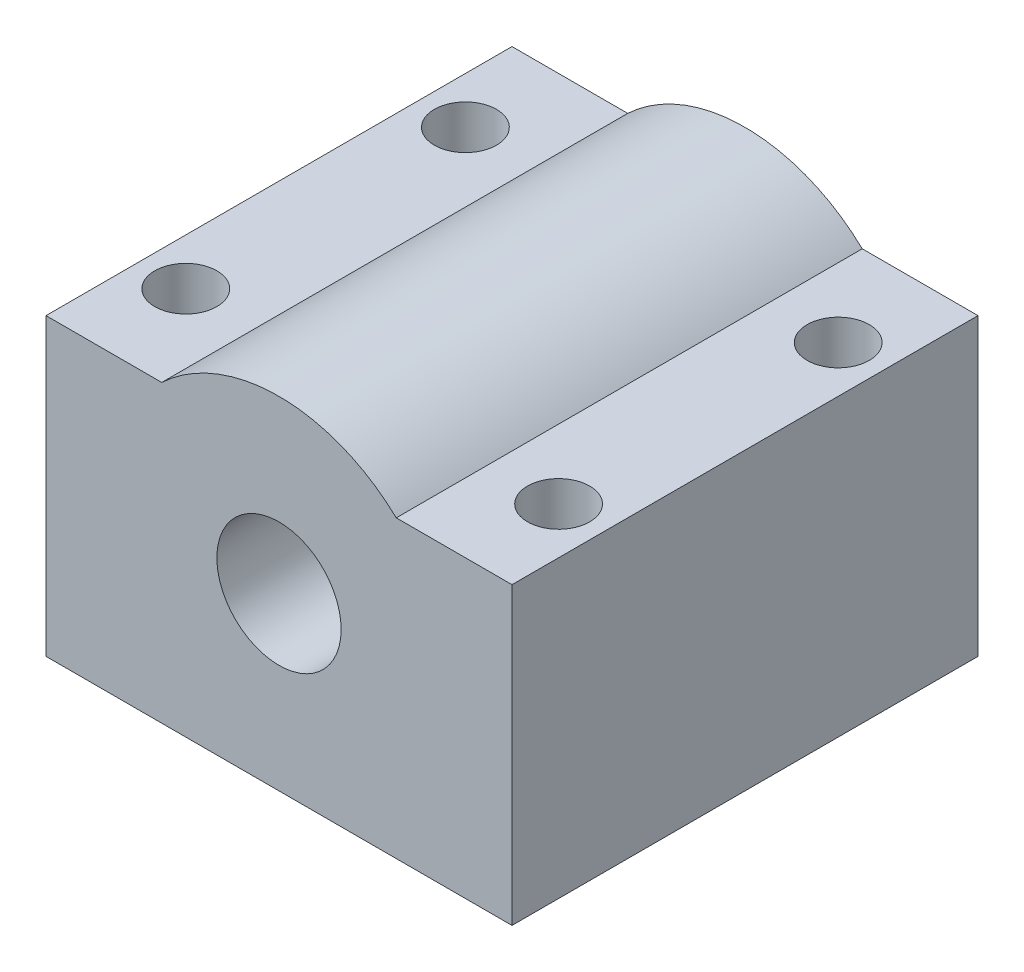
from build123d import *

# Parameters (mm, degrees)
SZKIC1_R                    = 11
SZKIC1_R_2                  = 4
DODANIE_WYCI_GNI_CIE1_DEPTH = 30
SZKIC5_W                    = 15
SZKIC5_H                    = 7
DODANIE_WYCI_GNI_CIE2_DEPTH = 30
SZKIC6_W                    = 15
SZKIC6_H                    = 7
DODANIE_WYCI_GNI_CIE3_DEPTH = 30
SZKIC7_W                    = 7.450165565
SZKIC7_H                    = 12
DODANIE_WYCI_GNI_CIE4_DEPTH = 30
WYTNIJ_WYCI_GNI_CIE1_REACH  = 42.112
SZKIC8_R                    = 2


with BuildPart() as part:
    # Szkic1 → Dodanie-wyciągnięcie1 (new body)
    with BuildSketch(Plane.XY):
        Circle(SZKIC1_R)
        Circle(SZKIC1_R_2, mode=Mode.SUBTRACT)
    extrude(amount=DODANIE_WYCI_GNI_CIE1_DEPTH)

    # Szkic5 → Dodanie-wyciągnięcie2 (add)
    with BuildSketch(Plane(origin=(0, 0, 0), x_dir=(-1, 0, 0), z_dir=(0, 0, -1))):
        with Locations((7.5, -7.5)):
            Rectangle(SZKIC5_W, SZKIC5_H)
    extrude(amount=-DODANIE_WYCI_GNI_CIE2_DEPTH)

    # Szkic6 → Dodanie-wyciągnięcie3 (add)
    with BuildSketch(Plane.XY):
        with Locations((7.5, -7.5)):
            Rectangle(SZKIC6_W, SZKIC6_H)
    extrude(amount=DODANIE_WYCI_GNI_CIE3_DEPTH)

    # Szkic7 → Dodanie-wyciągnięcie4 (add)
    with BuildSketch(Plane.XY):
        with Locations((11.274917218, 2)):
            Rectangle(SZKIC7_W, SZKIC7_H)
        with Locations((-11.274917218, 2)):
            Rectangle(SZKIC7_W, SZKIC7_H)
    extrude(amount=DODANIE_WYCI_GNI_CIE4_DEPTH)

    # Szkic8 → Wytnij-wyciągnięcie1 (cut, up to next)
    with BuildSketch(Plane.XZ.offset(11), mode=Mode.PRIVATE) as wytnij_wyci_gni_cie1_sk1:
        with Locations(Location((-12, 24, 0), (0, 0, 270))):
            Circle(SZKIC8_R)
    wytnij_wyci_gni_cie1_tool1 = extrude(wytnij_wyci_gni_cie1_sk1.sketch, amount=-WYTNIJ_WYCI_GNI_CIE1_REACH, mode=Mode.PRIVATE) & part.part
    # Szkic8 → Wytnij-wyciągnięcie1 (cut, up to next)
    with BuildSketch(Plane.XZ.offset(11), mode=Mode.PRIVATE) as wytnij_wyci_gni_cie1_sk2:
        with Locations(Location((12, 24, 0), (0, 0, 270))):
            Circle(SZKIC8_R)
    wytnij_wyci_gni_cie1_tool2 = extrude(wytnij_wyci_gni_cie1_sk2.sketch, amount=-WYTNIJ_WYCI_GNI_CIE1_REACH, mode=Mode.PRIVATE) & part.part
    # Szkic8 → Wytnij-wyciągnięcie1 (cut, up to next)
    with BuildSketch(Plane.XZ.offset(11), mode=Mode.PRIVATE) as wytnij_wyci_gni_cie1_sk3:
        with Locations(Location((12, 6, 0), (0, 0, 270))):
            Circle(SZKIC8_R)
    wytnij_wyci_gni_cie1_tool3 = extrude(wytnij_wyci_gni_cie1_sk3.sketch, amount=-WYTNIJ_WYCI_GNI_CIE1_REACH, mode=Mode.PRIVATE) & part.part
    # Szkic8 → Wytnij-wyciągnięcie1 (cut, up to next)
    with BuildSketch(Plane.XZ.offset(11), mode=Mode.PRIVATE) as wytnij_wyci_gni_cie1_sk4:
        with Locations(Location((-12, 6, 0), (0, 0, 270))):
            Circle(SZKIC8_R)
    wytnij_wyci_gni_cie1_tool4 = extrude(wytnij_wyci_gni_cie1_sk4.sketch, amount=-WYTNIJ_WYCI_GNI_CIE1_REACH, mode=Mode.PRIVATE) & part.part
    add(wytnij_wyci_gni_cie1_tool1.solids().sort_by_distance((-12, -11, 24))[0], mode=Mode.SUBTRACT)
    add(wytnij_wyci_gni_cie1_tool2.solids().sort_by_distance((12, -11, 24))[0], mode=Mode.SUBTRACT)
    add(wytnij_wyci_gni_cie1_tool3.solids().sort_by_distance((12, -11, 6))[0], mode=Mode.SUBTRACT)
    add(wytnij_wyci_gni_cie1_tool4.solids().sort_by_distance((-12, -11, 6))[0], mode=Mode.SUBTRACT)


solid = part.part
